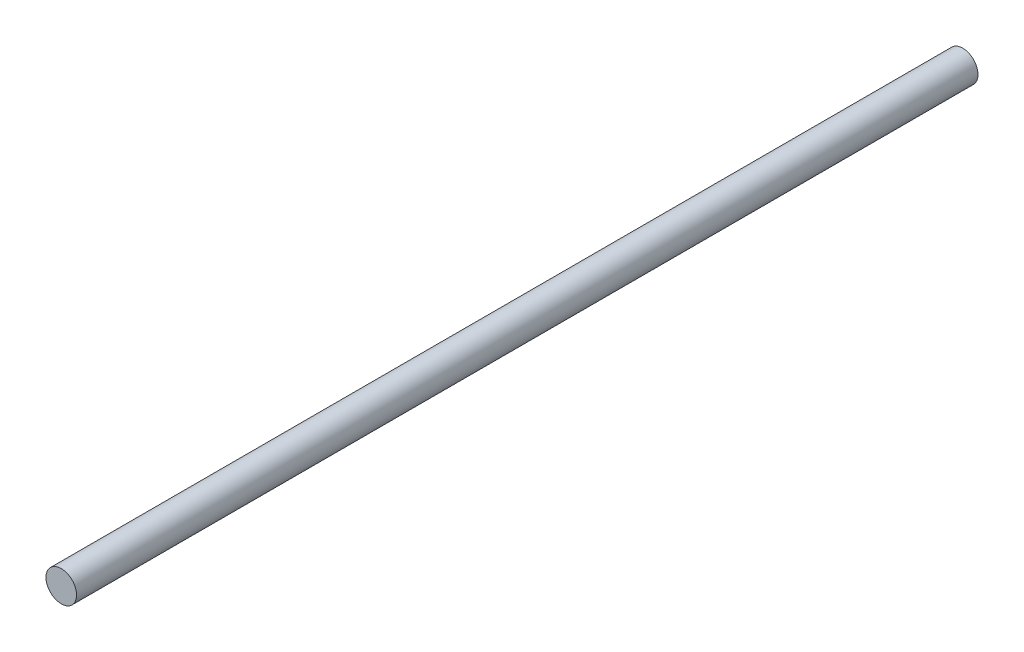
from build123d import *

# Parameters (mm, degrees)
SKETCH1_R           = 1.95
BOSS_EXTRUDE1_DEPTH = 115


with BuildPart() as part:
    # Sketch1 → Boss-Extrude1 (new body)
    with BuildSketch(Plane.XY):
        Circle(SKETCH1_R)
    extrude(amount=BOSS_EXTRUDE1_DEPTH)


solid = part.part
